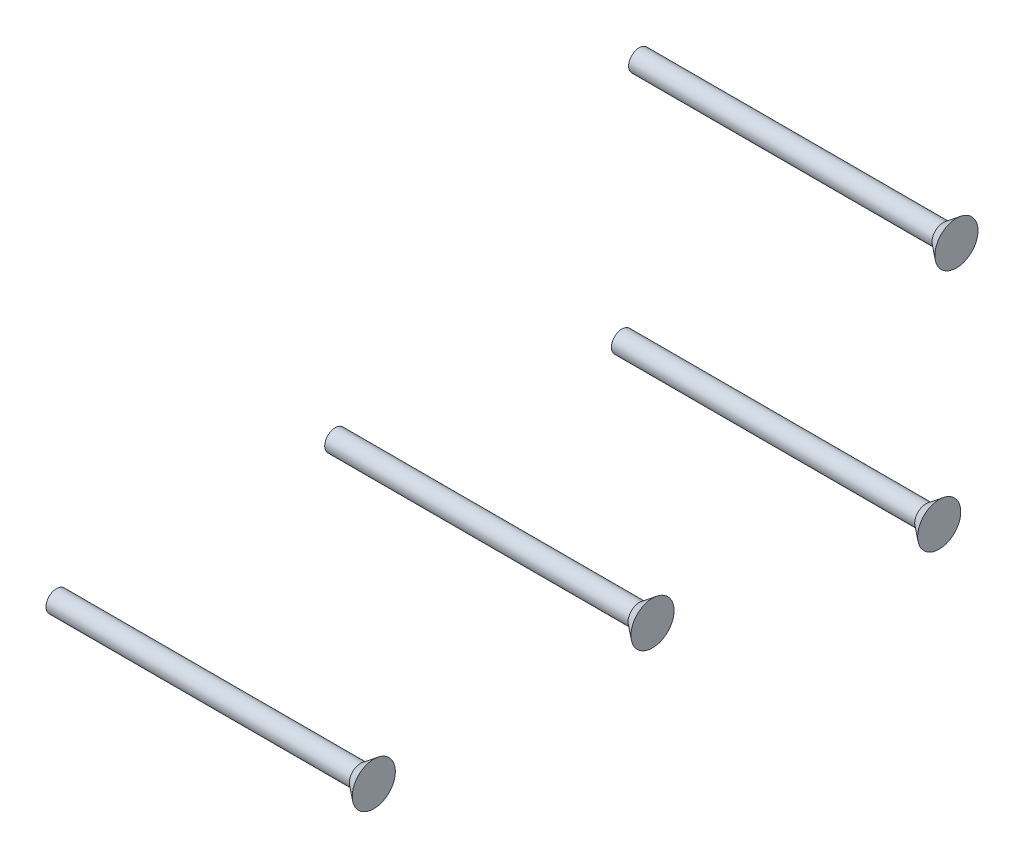
from build123d import *

# Parameters (mm, degrees)
SKETCH2_R                     = 2.032
BOSS_EXTRUDE1_DEPTH           = 60.706
BOSS_EXTRUDE1_2_DEPTH         = 60.706
BOSS_EXTRUDE1_3_DEPTH         = 60.706
BOSS_EXTRUDE1_4_DEPTH         = 60.706
SKETCH3_R                     = 4.1275
BOSS_EXTRUDE2_DEPTH           = 2.54
BOSS_EXTRUDE2_DRAFT           = -38
BOSS_EXTRUDE2_PROFILE_2_DEPTH = 2.54
BOSS_EXTRUDE2_PROFILE_2_DRAFT = -38
BOSS_EXTRUDE2_PROFILE_3_DEPTH = 2.54
BOSS_EXTRUDE2_PROFILE_3_DRAFT = -38
BOSS_EXTRUDE2_PROFILE_4_DEPTH = 2.54
BOSS_EXTRUDE2_PROFILE_4_DRAFT = -38


with BuildPart() as part:
    # Sketch2 → Boss-Extrude1 (new body)
    with BuildSketch(Plane(origin=(0, 0, 0), x_dir=(0, 0, -1), z_dir=(1, 0, 0))):
        with Locations((-53.34, 0)):
            Circle(SKETCH2_R)
    extrude(amount=BOSS_EXTRUDE1_DEPTH)


with BuildPart() as body_2:
    # Sketch2 → Boss-Extrude1 2 (new body)
    with BuildSketch(Plane(origin=(0, 0, 0), x_dir=(0, 0, -1), z_dir=(1, 0, 0))):
        Circle(SKETCH2_R)
    extrude(amount=BOSS_EXTRUDE1_2_DEPTH)


with BuildPart() as body_3:
    # Sketch2 → Boss-Extrude1 3 (new body)
    with BuildSketch(Plane(origin=(0, 0, 0), x_dir=(0, 0, -1), z_dir=(1, 0, 0))):
        with Locations((54.864, -11.07186)):
            Circle(SKETCH2_R)
    extrude(amount=BOSS_EXTRUDE1_3_DEPTH)


with BuildPart() as body_4:
    # Sketch2 → Boss-Extrude1 4 (new body)
    with BuildSketch(Plane(origin=(0, 0, 0), x_dir=(0, 0, -1), z_dir=(1, 0, 0))):
        with Locations((58.166, 33.88614)):
            Circle(SKETCH2_R)
    extrude(amount=BOSS_EXTRUDE1_4_DEPTH)


with BuildPart() as boss_extrude2_tool:
    # Sketch3 → Boss-Extrude2 (with draft: the straight prism first)
    with BuildSketch(Plane(origin=(60.706, 0, 0), x_dir=(0, 0, -1), z_dir=(1, 0, 0))):
        with Locations((-53.34, 0)):
            Circle(SKETCH3_R)
    extrude(amount=-BOSS_EXTRUDE2_DEPTH)
    # Boss-Extrude2: the draft: its side faces are tilted about the plane it starts from
    boss_extrude2_sides = [boss_extrude2_tool.faces().sort_by_distance(p)[0] for p in [
        (59.436, 0, 57.4675),
    ]]
    draft(boss_extrude2_sides, Plane(origin=(60.706, 0, 0), x_dir=(0, 0, -1), z_dir=(1, 0, 0)), BOSS_EXTRUDE2_DRAFT)


with BuildPart() as part_1:
    add(part.part)

    # Boss-Extrude2: add boss_extrude2_tool
    add(boss_extrude2_tool.part)

    add(body_2.part)  # Boss-Extrude2 merges body 2

    add(body_3.part)  # Boss-Extrude2 merges body 3

    add(body_4.part)  # Boss-Extrude2 merges body 4


with BuildPart() as boss_extrude2_profile_2_tool:
    # Sketch3 → Boss-Extrude2 profile 2 (with draft: the straight prism first)
    with BuildSketch(Plane(origin=(60.706, 0, 0), x_dir=(0, 0, -1), z_dir=(1, 0, 0))):
        Circle(SKETCH3_R)
    extrude(amount=-BOSS_EXTRUDE2_PROFILE_2_DEPTH)
    # Boss-Extrude2 profile 2: the draft: its side faces are tilted about the plane it starts from
    boss_extrude2_profile_2_sides = [boss_extrude2_profile_2_tool.faces().sort_by_distance(p)[0] for p in [
        (59.436, 0, 4.1275),
    ]]
    draft(boss_extrude2_profile_2_sides, Plane(origin=(60.706, 0, 0), x_dir=(0, 0, -1), z_dir=(1, 0, 0)), BOSS_EXTRUDE2_PROFILE_2_DRAFT)


with BuildPart() as part_2:
    add(part_1.part)

    # Boss-Extrude2 profile 2: add boss_extrude2_profile_2_tool
    add(boss_extrude2_profile_2_tool.part)


with BuildPart() as boss_extrude2_profile_3_tool:
    # Sketch3 → Boss-Extrude2 profile 3 (with draft: the straight prism first)
    with BuildSketch(Plane(origin=(60.706, 0, 0), x_dir=(0, 0, -1), z_dir=(1, 0, 0))):
        with Locations((58.166, 33.88614)):
            Circle(SKETCH3_R)
    extrude(amount=-BOSS_EXTRUDE2_PROFILE_3_DEPTH)
    # Boss-Extrude2 profile 3: the draft: its side faces are tilted about the plane it starts from
    boss_extrude2_profile_3_sides = [boss_extrude2_profile_3_tool.faces().sort_by_distance(p)[0] for p in [
        (59.436, 33.88614, -54.0385),
    ]]
    draft(boss_extrude2_profile_3_sides, Plane(origin=(60.706, 0, 0), x_dir=(0, 0, -1), z_dir=(1, 0, 0)), BOSS_EXTRUDE2_PROFILE_3_DRAFT)


with BuildPart() as part_3:
    add(part_2.part)

    # Boss-Extrude2 profile 3: add boss_extrude2_profile_3_tool
    add(boss_extrude2_profile_3_tool.part)


with BuildPart() as boss_extrude2_profile_4_tool:
    # Sketch3 → Boss-Extrude2 profile 4 (with draft: the straight prism first)
    with BuildSketch(Plane(origin=(60.706, 0, 0), x_dir=(0, 0, -1), z_dir=(1, 0, 0))):
        with Locations((54.864, -11.07186)):
            Circle(SKETCH3_R)
    extrude(amount=-BOSS_EXTRUDE2_PROFILE_4_DEPTH)
    # Boss-Extrude2 profile 4: the draft: its side faces are tilted about the plane it starts from
    boss_extrude2_profile_4_sides = [boss_extrude2_profile_4_tool.faces().sort_by_distance(p)[0] for p in [
        (59.436, -11.07186, -50.7365),
    ]]
    draft(boss_extrude2_profile_4_sides, Plane(origin=(60.706, 0, 0), x_dir=(0, 0, -1), z_dir=(1, 0, 0)), BOSS_EXTRUDE2_PROFILE_4_DRAFT)


with BuildPart() as part_4:
    add(part_3.part)

    # Boss-Extrude2 profile 4: add boss_extrude2_profile_4_tool
    add(boss_extrude2_profile_4_tool.part)


solid = part_4.part
